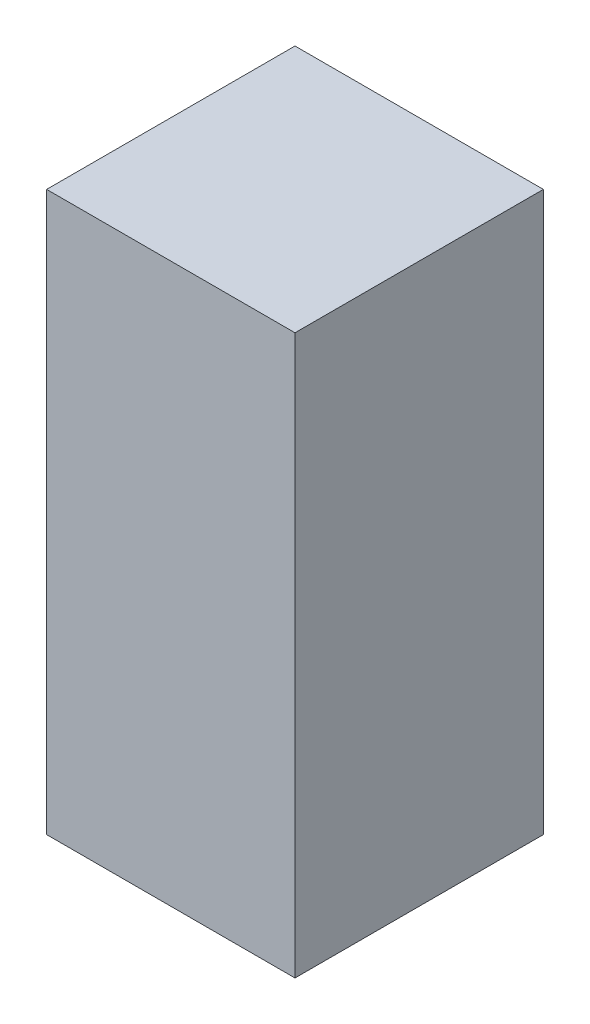
from build123d import *

# Parameters (mm, degrees)
PACK_KOSE_PLOWU_4_1_START = -227.5
SKETCH1_W                 = 20
SKETCH1_H                 = 45
PACK_KOSE_PLOWU_4_1_DEPTH = 20


with BuildPart() as part:
    # Sketch1 → PACK_kose_plowu_4_1 (new body)
    with BuildSketch(Plane.XY.offset(PACK_KOSE_PLOWU_4_1_START)):
        with Locations((512.5, 574.5)):
            Rectangle(SKETCH1_W, SKETCH1_H)
    extrude(amount=-PACK_KOSE_PLOWU_4_1_DEPTH)


solid = part.part
